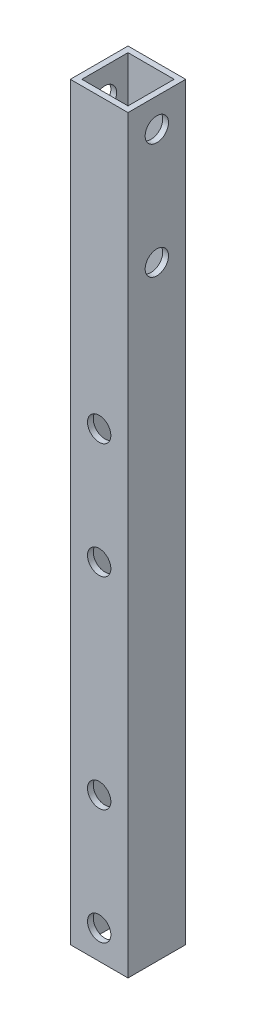
from build123d import *

# Parameters (mm, degrees)
SKETCH1_W           = 10
SKETCH1_H           = 10
SKETCH1_W_2         = 8
SKETCH1_H_2         = 8
BOSS_EXTRUDE1_DEPTH = 130
SKETCH2_R           = 2.025
CUT_EXTRUDE1_DEPTH  = 131.479883507
SKETCH3_R           = 2.025
CUT_EXTRUDE2_DEPTH  = 131.479883507
SKETCH4_R           = 2.025
CUT_EXTRUDE3_DEPTH  = 131.479883507


with BuildPart() as part:
    # Sketch1 → Boss-Extrude1 (new body)
    with BuildSketch(Plane(origin=(0, 0, 0), x_dir=(1, 0, 0), z_dir=(0, 1, 0))):
        Rectangle(SKETCH1_W, SKETCH1_H)
        Rectangle(SKETCH1_W_2, SKETCH1_H_2, mode=Mode.SUBTRACT)
    extrude(amount=BOSS_EXTRUDE1_DEPTH)

    # Sketch2 → Cut-Extrude1 (cut, through all)
    with BuildSketch(Plane.XY.offset(5)):
        with Locations((0, 5)):
            Circle(SKETCH2_R)
        with Locations((0, 25)):
            Circle(SKETCH2_R)
    extrude(amount=-CUT_EXTRUDE1_DEPTH, mode=Mode.SUBTRACT)

    # Sketch3 → Cut-Extrude2 (cut, through all)
    with BuildSketch(Plane(origin=(5, 0, 0), x_dir=(0, 0, -1), z_dir=(1, 0, 0))):
        with Locations((0, 125)):
            Circle(SKETCH3_R)
        with Locations((0, 105)):
            Circle(SKETCH3_R)
    extrude(amount=-CUT_EXTRUDE2_DEPTH, mode=Mode.SUBTRACT)

    # Sketch4 → Cut-Extrude3 (cut, through all)
    with BuildSketch(Plane.XY.offset(5)):
        with Locations((0, 60)):
            Circle(SKETCH4_R)
        with Locations((0, 80)):
            Circle(SKETCH4_R)
    extrude(amount=-CUT_EXTRUDE3_DEPTH, mode=Mode.SUBTRACT)


solid = part.part
